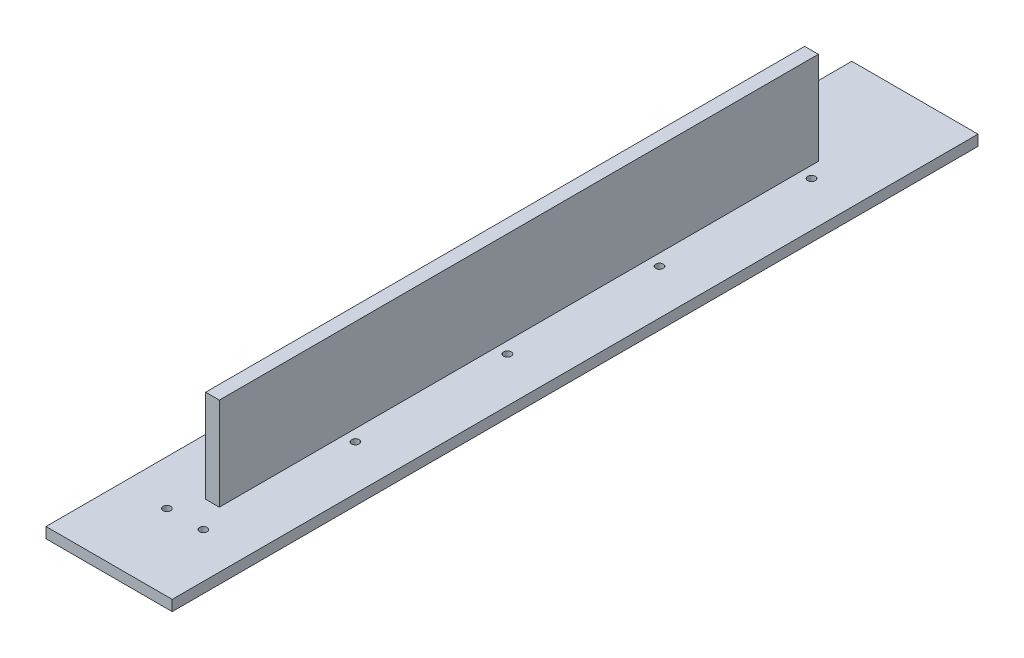
from build123d import *

# Parameters (mm, degrees)
BOSS_EXTRU_1_DEPTH      = 530
ESQUISSE2_W             = 68
ESQUISSE2_H             = 61
ENL_V_MAT_EXTRU_1_DEPTH = 9
ESQUISSE3_R             = 2.5
ENL_V_MAT_EXTRU_2_DEPTH = 7


with BuildPart() as part:
    # Esquisse1 → Boss.-Extru.1 (new body)
    with BuildSketch(Plane.XY):
        Polygon((0, 0), (83, 0), (83, 7), (46, 7), (46, 68), (37, 68), (37, 7), (0, 7), align=None)
    extrude(amount=BOSS_EXTRU_1_DEPTH)

    # Esquisse2 → Enlèv. mat.-Extru.1 (cut)
    with BuildSketch(Plane.ZY.offset(-37)):
        with Locations((34, 37.5)):
            Rectangle(ESQUISSE2_W, ESQUISSE2_H)
        with Locations((496, 37.5)):
            Rectangle(ESQUISSE2_W, ESQUISSE2_H)
    extrude(amount=-ENL_V_MAT_EXTRU_1_DEPTH, mode=Mode.SUBTRACT)

    # Esquisse3 → Enlèv. mat.-Extru.2 (cut)
    with BuildSketch(Plane.XZ):
        with Locations(Location((29.5, 80, 0), (0, 0, 270))):
            Circle(ESQUISSE3_R)
        with Locations(Location((53.5, 80, 0), (0, 0, 90))):
            Circle(ESQUISSE3_R)
        with Locations(Location((29.5, 180, 0), (0, 0, 270))):
            Circle(ESQUISSE3_R)
        with Locations(Location((53.5, 180, 0), (0, 0, 90))):
            Circle(ESQUISSE3_R)
        with Locations(Location((29.5, 280, 0), (0, 0, 270))):
            Circle(ESQUISSE3_R)
        with Locations(Location((53.5, 280, 0), (0, 0, 90))):
            Circle(ESQUISSE3_R)
        with Locations(Location((29.5, 380, 0), (0, 0, 270))):
            Circle(ESQUISSE3_R)
        with Locations(Location((53.5, 380, 0), (0, 0, 90))):
            Circle(ESQUISSE3_R)
        with Locations(Location((29.5, 480, 0), (0, 0, 270))):
            Circle(ESQUISSE3_R)
        with Locations(Location((53.5, 480, 0), (0, 0, 90))):
            Circle(ESQUISSE3_R)
    extrude(amount=-ENL_V_MAT_EXTRU_2_DEPTH, mode=Mode.SUBTRACT)


solid = part.part
